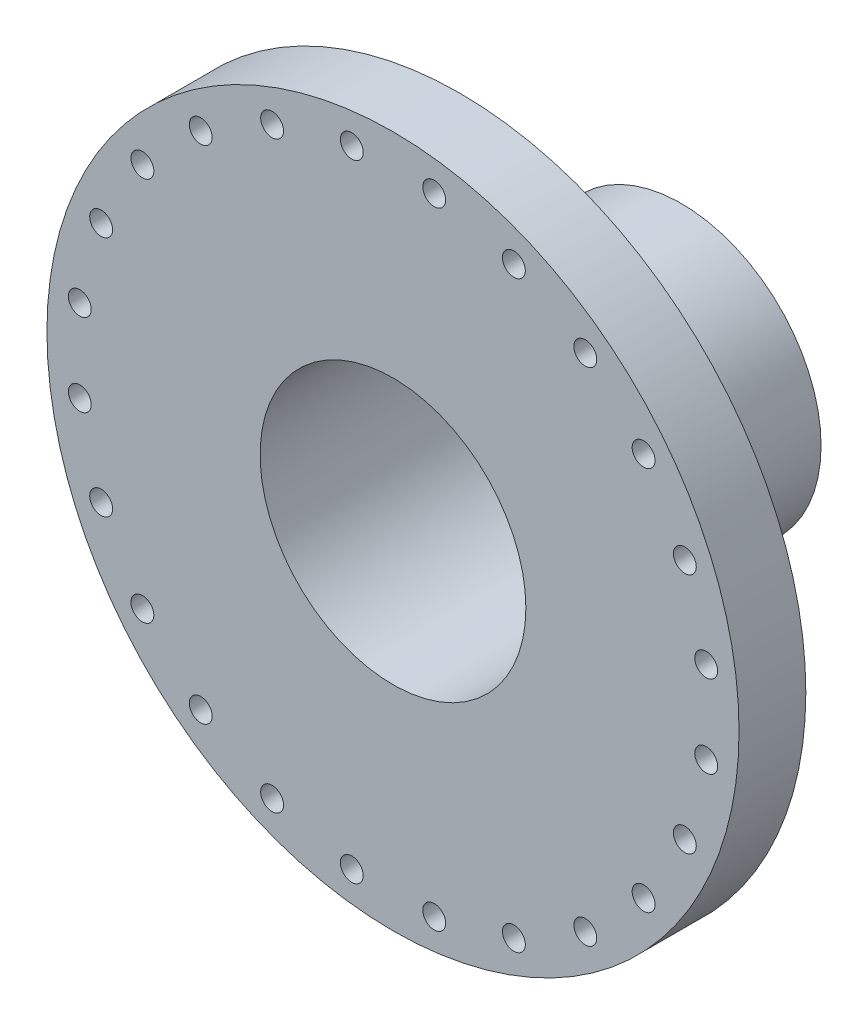
from build123d import *

# Parameters (mm, degrees)
SKETCH1_R          = 51.308
SKETCH1_R_2        = 48.768
EXTRUDE1_DEPTH     = 81.28
EXTRUDE2_START     = 24.511
SKETCH2_R          = 127
SKETCH2_R_2        = 48.768
EXTRUDE2_DEPTH     = 24.511
CUT_EXTRUDE1_REACH = 210.446
SKETCH3_R          = 4.2
CIRPATTERN1_COUNT  = 24
EXTRUDE3_START     = -2.54
SKETCH4_R          = 51.308
SKETCH4_R_2        = 25.4
EXTRUDE3_DEPTH     = 2.54


with BuildPart() as part:
    # Sketch1 → Extrude1 (new body)
    with BuildSketch(Plane.XY):
        Circle(SKETCH1_R)
        Circle(SKETCH1_R_2, mode=Mode.SUBTRACT)
    extrude(amount=-EXTRUDE1_DEPTH)

    # Sketch2 → Extrude2 (add)
    with BuildSketch(Plane.XY.offset(EXTRUDE2_START)):
        Circle(SKETCH2_R)
        Circle(SKETCH2_R_2, mode=Mode.SUBTRACT)
    extrude(amount=-EXTRUDE2_DEPTH)

    # Sketch3 → Cut-Extrude1 (cut, up to next)
    with BuildSketch(Plane.XY.offset(24.511), mode=Mode.PRIVATE) as cut_extrude1_sk1:
        with Locations((15.131327149, -114.933840422)):
            Circle(SKETCH3_R)
    cut_extrude1_tool1 = extrude(cut_extrude1_sk1.sketch, amount=-CUT_EXTRUDE1_REACH, mode=Mode.PRIVATE) & part.part
    cut_extrude1 = cut_extrude1_tool1.solids().sort_by_distance((15.131327, -114.93384, 24.511))[0]
    add(cut_extrude1, mode=Mode.SUBTRACT)

    # CirPattern1: Cut-Extrude1 ×24 about axis
    cirpattern1_axis = Axis((0, 0, 0), (0, 0, 1))
    for i in range(1, CIRPATTERN1_COUNT):
        add(cut_extrude1.rotate(cirpattern1_axis, i * 360 / CIRPATTERN1_COUNT), mode=Mode.SUBTRACT)

    # Sketch4 → Extrude3 (add)
    with BuildSketch(Plane(origin=(0, 0, -81.28), x_dir=(-1, 0, 0), z_dir=(0, 0, -1)).offset(EXTRUDE3_START)):
        with Locations(Location((0, 0, 0), (0, 0, 180))):
            Circle(SKETCH4_R)
        Circle(SKETCH4_R_2, mode=Mode.SUBTRACT)
    extrude(amount=EXTRUDE3_DEPTH)


solid = part.part
